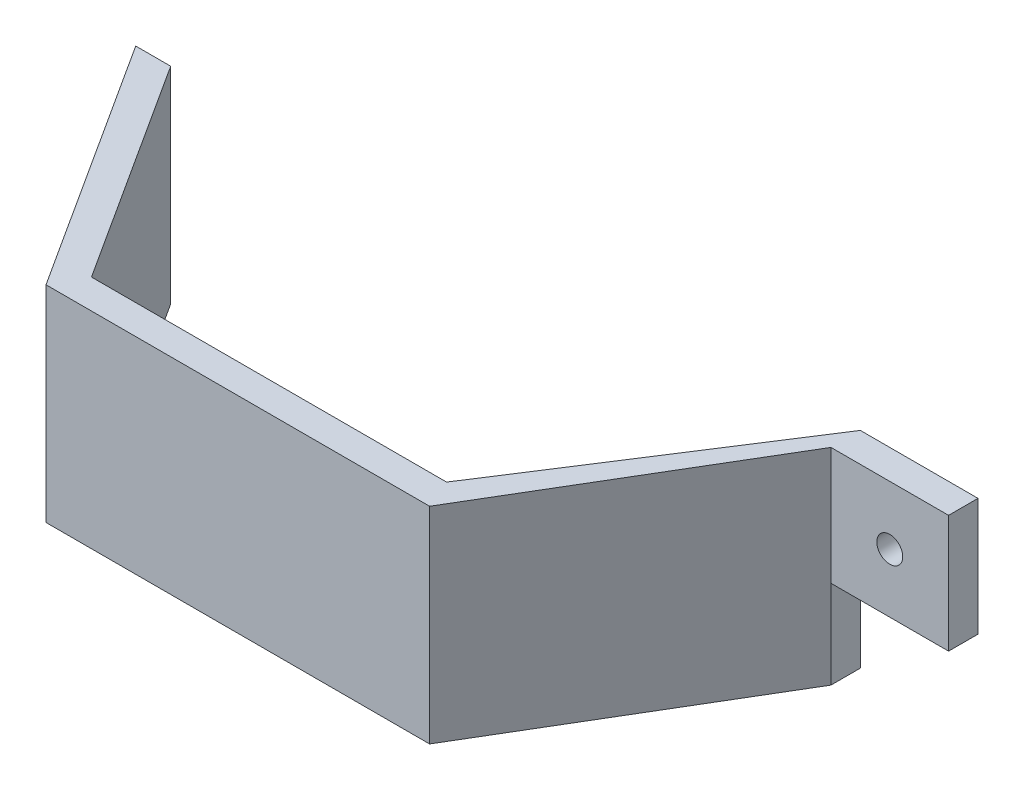
from build123d import *

# Parameters (mm, degrees)
ESQUISSE2_W             = 20
ESQUISSE2_H             = 20
BOSS_EXTRU_1_DEPTH      = 5
ESQUISSE3_R             = 2.2
ENL_V_MAT_EXTRU_1_DEPTH = 5
BOSS_EXTRU_2_DEPTH      = 35


with BuildPart() as part:
    # Esquisse2 → Boss.-Extru.1 (new body)
    with BuildSketch(Plane.XY):
        with Locations((0.050251256, -0.301507538)):
            Rectangle(ESQUISSE2_W, ESQUISSE2_H)
    extrude(amount=BOSS_EXTRU_1_DEPTH)

    # Esquisse3 → Enlèv. mat.-Extru.1 (cut)
    with BuildSketch(Plane.XY.offset(5)):
        with Locations((0.050251256, -0.301507538)):
            Circle(ESQUISSE3_R)
    extrude(amount=-ENL_V_MAT_EXTRU_1_DEPTH, mode=Mode.SUBTRACT)

    # Esquisse4 → Boss.-Extru.2 (add)
    with BuildSketch(Plane(origin=(0, 9.698492462, 0), x_dir=(1, 0, 0), z_dir=(0, 1, 0))):
        Polygon((-9.949748744, -5), (-35.398476961, -47.775171076), (-100.606984649, -47.775171076), (-128.128833484, -5), (-122.183304286, -5), (-97.878490958, -42.775171076), (-37.511283693, -42.775171076), (-9.949748744, 0), align=None)
    extrude(amount=-BOSS_EXTRU_2_DEPTH)


solid = part.part
